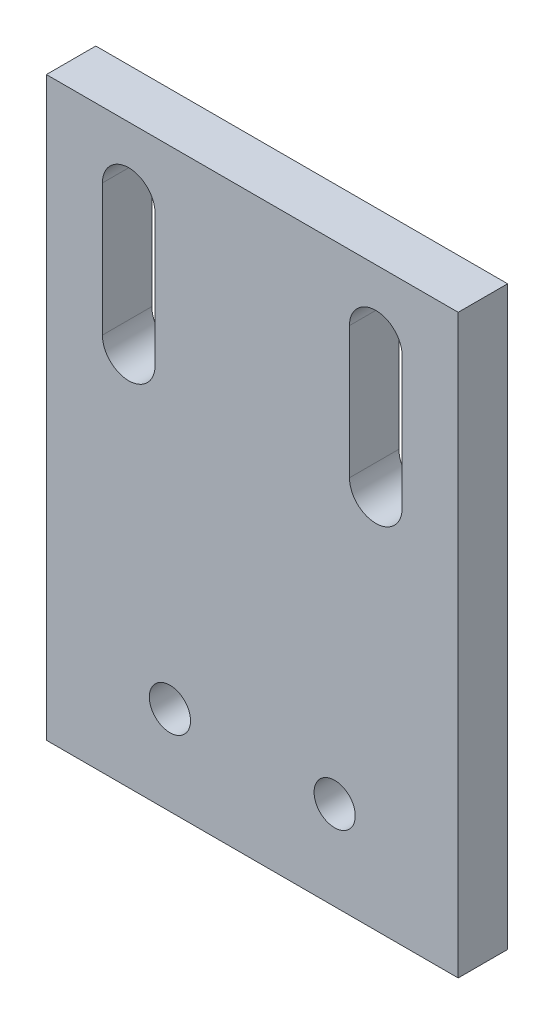
from build123d import *

# Parameters (mm, degrees)
SKETCH_1_W          = 25
SKETCH_1_H          = 35
EXTRUDE_1_DEPTH     = 3
M3X0_5_1_D          = 2.5
CUT_EXTRUDE_1_DEPTH = 140.062386204


with BuildPart() as part:
    # 草图1 → 凸台-拉伸1 (new body)
    with BuildSketch(Plane.XY):
        with Locations((122.531636064, 15.602938216)):
            Rectangle(SKETCH_1_W, SKETCH_1_H)
    extrude(amount=EXTRUDE_1_DEPTH)

    # M3x0.5 螺纹孔1 (through all)
    with Locations(Plane.XY.offset(3)):
        with Locations((117.531636064, 3.5), (127.531636064, 3.5)):
            Hole(M3X0_5_1_D / 2)

    # 草图4 → 切除-拉伸1 (cut, through all)
    with BuildSketch(Plane.XY.offset(3)):
        with BuildLine():
            Line((116.631636064, 29.102938216), (116.631636064, 21.102938216))
            ThreePointArc((116.631636064, 21.102938216), (115.031636064, 19.502938216), (113.431636064, 21.102938216))
            Line((113.431636064, 21.102938216), (113.431636064, 29.102938216))
            ThreePointArc((113.431636064, 29.102938216), (115.031636064, 30.702938216), (116.631636064, 29.102938216))
        make_face()
        with BuildLine():
            Line((131.631636064, 29.102938216), (131.631636064, 21.102938216))
            ThreePointArc((131.631636064, 21.102938216), (130.031636064, 19.502938216), (128.431636064, 21.102938216))
            Line((128.431636064, 21.102938216), (128.431636064, 29.102938216))
            ThreePointArc((128.431636064, 29.102938216), (130.031636064, 30.702938216), (131.631636064, 29.102938216))
        make_face()
    extrude(amount=-CUT_EXTRUDE_1_DEPTH, mode=Mode.SUBTRACT)


solid = part.part
